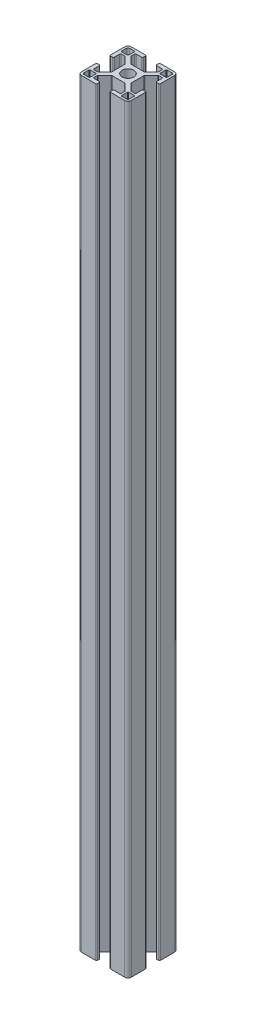
from build123d import *

# Parameters (mm, degrees)
SKETCH1_R           = 3.52998588
BOSS_EXTRUDE1_DEPTH = 228.6


with BuildPart() as part:
    # Sketch1 → Boss-Extrude1 (new, symmetric)
    with BuildSketch(Plane(origin=(0, 0, 0), x_dir=(1, 0, 0), z_dir=(0, 1, 0))):
        with BuildLine():
            Line((14.49994, -4), (13.24247465, -4))
            ThreePointArc((13.24247465, -4), (12.88892126, -4.146446609), (12.74247465, -4.5))
            Line((12.74247465, -4.5), (12.74247465, -7.732519321))
            ThreePointArc((12.74247465, -7.732519321), (12.602449697, -8.097296796), (12.242781236, -8.249967))
            Line((12.242781236, -8.249967), (10.260188032, -8.249967))
            ThreePointArc((10.260188032, -8.249967), (10.068847082, -8.211906919), (9.906636056, -8.103520976))
            Line((9.906636056, -8.103520976), (5.981117769, -4.178002689))
            ThreePointArc((5.981117769, -4.178002689), (5.872731827, -4.015791664), (5.834671745, -3.824450713))
            Line((5.834671745, -3.824450713), (5.834671745, -1.01249595))
            Line((5.834671745, -1.01249595), (5.834671745, 0.88749645))
            Line((5.834671745, 0.88749645), (5.834671745, 3.824450713))
            ThreePointArc((5.834671745, 3.824450713), (5.872731827, 4.015791664), (5.981117769, 4.178002689))
            Line((5.981117769, 4.178002689), (9.906636056, 8.103520976))
            ThreePointArc((9.906636056, 8.103520976), (10.068847082, 8.211906919), (10.260188032, 8.249967))
            Line((10.260188032, 8.249967), (12.242781236, 8.249967))
            ThreePointArc((12.242781236, 8.249967), (12.602449697, 8.097296796), (12.74247465, 7.732519321))
            Line((12.74247465, 7.732519321), (12.74247465, 4.5))
            ThreePointArc((12.74247465, 4.5), (12.88892126, 4.146446609), (13.24247465, 4))
            Line((13.24247465, 4), (14.49994, 4))
            ThreePointArc((14.49994, 4), (14.853493391, 4.146446609), (14.99994, 4.5))
            Line((14.99994, 4.5), (14.99994, 12.999948))
            ThreePointArc((14.99994, 12.999948), (14.414155906, 14.414155906), (12.999948, 14.99994))
            Line((12.999948, 14.99994), (4.5, 14.99994))
            ThreePointArc((4.5, 14.99994), (4.146446609, 14.853493391), (4, 14.49994))
            Line((4, 14.49994), (4, 13.24247465))
            ThreePointArc((4, 13.24247465), (4.146446609, 12.88892126), (4.5, 12.74247465))
            Line((4.5, 12.74247465), (7.732519321, 12.74247465))
            ThreePointArc((7.732519321, 12.74247465), (8.097296796, 12.602449697), (8.249967, 12.242781236))
            Line((8.249967, 12.242781236), (8.249967, 10.260188032))
            ThreePointArc((8.249967, 10.260188032), (8.211906919, 10.068847082), (8.103520976, 9.906636056))
            Line((8.103520976, 9.906636056), (4.178002689, 5.981117769))
            ThreePointArc((4.178002689, 5.981117769), (4.015791664, 5.872731827), (3.824450713, 5.834671745))
            Line((3.824450713, 5.834671745), (0.9499962, 5.834671745))
            Line((0.9499962, 5.834671745), (-0.9499962, 5.834671745))
            Line((-0.9499962, 5.834671745), (-3.824450713, 5.834671745))
            ThreePointArc((-3.824450713, 5.834671745), (-4.015791664, 5.872731827), (-4.178002689, 5.981117769))
            Line((-4.178002689, 5.981117769), (-8.103520976, 9.906636056))
            ThreePointArc((-8.103520976, 9.906636056), (-8.211906919, 10.068847082), (-8.249967, 10.260188032))
            Line((-8.249967, 10.260188032), (-8.249967, 12.242781236))
            ThreePointArc((-8.249967, 12.242781236), (-8.097296796, 12.602449697), (-7.732519321, 12.74247465))
            Line((-7.732519321, 12.74247465), (-4.5, 12.74247465))
            ThreePointArc((-4.5, 12.74247465), (-4.146446609, 12.88892126), (-4, 13.24247465))
            Line((-4, 13.24247465), (-4, 14.49994))
            ThreePointArc((-4, 14.49994), (-4.146446609, 14.853493391), (-4.5, 14.99994))
            Line((-4.5, 14.99994), (-12.999948, 14.99994))
            ThreePointArc((-12.999948, 14.99994), (-14.414155906, 14.414155906), (-14.99994, 12.999948))
            Line((-14.99994, 12.999948), (-14.99994, 4.5))
            ThreePointArc((-14.99994, 4.5), (-14.853493391, 4.146446609), (-14.49994, 4))
            Line((-14.49994, 4), (-13.24247465, 4))
            ThreePointArc((-13.24247465, 4), (-12.88892126, 4.146446609), (-12.74247465, 4.5))
            Line((-12.74247465, 4.5), (-12.74247465, 7.732519321))
            ThreePointArc((-12.74247465, 7.732519321), (-12.602449697, 8.097296796), (-12.242781236, 8.249967))
            Line((-12.242781236, 8.249967), (-10.260188032, 8.249967))
            ThreePointArc((-10.260188032, 8.249967), (-10.068847082, 8.211906919), (-9.906636056, 8.103520976))
            Line((-9.906636056, 8.103520976), (-5.981117769, 4.178002689))
            ThreePointArc((-5.981117769, 4.178002689), (-5.872731827, 4.015791664), (-5.834671745, 3.824450713))
            Line((-5.834671745, 3.824450713), (-5.834671745, 0.88749645))
            Line((-5.834671745, 0.88749645), (-5.834671745, -1.01249595))
            Line((-5.834671745, -1.01249595), (-5.834671745, -3.824450713))
            ThreePointArc((-5.834671745, -3.824450713), (-5.872731827, -4.015791664), (-5.981117769, -4.178002689))
            Line((-5.981117769, -4.178002689), (-9.906636056, -8.103520976))
            ThreePointArc((-9.906636056, -8.103520976), (-10.068847082, -8.211906919), (-10.260188032, -8.249967))
            Line((-10.260188032, -8.249967), (-12.242781236, -8.249967))
            ThreePointArc((-12.242781236, -8.249967), (-12.602449697, -8.097296796), (-12.74247465, -7.732519321))
            Line((-12.74247465, -7.732519321), (-12.74247465, -4.5))
            ThreePointArc((-12.74247465, -4.5), (-12.88892126, -4.146446609), (-13.24247465, -4))
            Line((-13.24247465, -4), (-14.49994, -4))
            ThreePointArc((-14.49994, -4), (-14.853493391, -4.146446609), (-14.99994, -4.5))
            Line((-14.99994, -4.5), (-14.99994, -12.999948))
            ThreePointArc((-14.99994, -12.999948), (-14.414155906, -14.414155906), (-12.999948, -14.99994))
            Line((-12.999948, -14.99994), (-4.5, -14.99994))
            ThreePointArc((-4.5, -14.99994), (-4.146446609, -14.853493391), (-4, -14.49994))
            Line((-4, -14.49994), (-4, -13.24247465))
            ThreePointArc((-4, -13.24247465), (-4.146446609, -12.88892126), (-4.5, -12.74247465))
            Line((-4.5, -12.74247465), (-7.732519321, -12.74247465))
            ThreePointArc((-7.732519321, -12.74247465), (-8.097296796, -12.602449697), (-8.249967, -12.242781236))
            Line((-8.249967, -12.242781236), (-8.249967, -10.260188032))
            ThreePointArc((-8.249967, -10.260188032), (-8.211906919, -10.068847082), (-8.103520976, -9.906636056))
            Line((-8.103520976, -9.906636056), (-4.178002689, -5.981117769))
            ThreePointArc((-4.178002689, -5.981117769), (-4.015791664, -5.872731827), (-3.824450713, -5.834671745))
            Line((-3.824450713, -5.834671745), (-0.9499962, -5.834671745))
            Line((-0.9499962, -5.834671745), (0.9499962, -5.834671745))
            Line((0.9499962, -5.834671745), (3.824450713, -5.834671745))
            ThreePointArc((3.824450713, -5.834671745), (4.015791664, -5.872731827), (4.178002689, -5.981117769))
            Line((4.178002689, -5.981117769), (8.103520976, -9.906636056))
            ThreePointArc((8.103520976, -9.906636056), (8.211906919, -10.068847082), (8.249967, -10.260188032))
            Line((8.249967, -10.260188032), (8.249967, -12.242781236))
            ThreePointArc((8.249967, -12.242781236), (8.097296796, -12.602449697), (7.732519321, -12.74247465))
            Line((7.732519321, -12.74247465), (4.5, -12.74247465))
            ThreePointArc((4.5, -12.74247465), (4.146446609, -12.88892126), (4, -13.24247465))
            Line((4, -13.24247465), (4, -14.49994))
            ThreePointArc((4, -14.49994), (4.146446609, -14.853493391), (4.5, -14.99994))
            Line((4.5, -14.99994), (12.999948, -14.99994))
            ThreePointArc((12.999948, -14.99994), (14.414155906, -14.414155906), (14.99994, -12.999948))
            Line((14.99994, -12.999948), (14.99994, -4.5))
            ThreePointArc((14.99994, -4.5), (14.853493391, -4.146446609), (14.49994, -4))
        make_face()
        with Locations(Location((0, 0, 0), (0, 0, 270))):
            Circle(SKETCH1_R, mode=Mode.SUBTRACT)
        with BuildLine():
            Line((-12.6999492, -13.6999452), (-9.880960476, -13.6999452))
            ThreePointArc((-9.880960476, -13.6999452), (-9.61155387, -13.58835333), (-9.499962, -13.318946724))
            Line((-9.499962, -13.318946724), (-9.499962, -9.87996048))
            ThreePointArc((-9.499962, -9.87996048), (-9.611260978, -9.611260978), (-9.87996048, -9.499962))
            Line((-9.87996048, -9.499962), (-13.318946724, -9.499962))
            ThreePointArc((-13.318946724, -9.499962), (-13.58835333, -9.61155387), (-13.6999452, -9.880960476))
            Line((-13.6999452, -9.880960476), (-13.6999452, -12.6999492))
            ThreePointArc((-13.6999452, -12.6999492), (-13.407053153, -13.407053153), (-12.6999492, -13.6999452))
        make_face(mode=Mode.SUBTRACT)
        with BuildLine():
            Line((13.6999452, -12.6999492), (13.6999452, -9.880960476))
            ThreePointArc((13.6999452, -9.880960476), (13.58835333, -9.61155387), (13.318946724, -9.499962))
            Line((13.318946724, -9.499962), (9.87996048, -9.499962))
            ThreePointArc((9.87996048, -9.499962), (9.611260978, -9.611260978), (9.499962, -9.87996048))
            Line((9.499962, -9.87996048), (9.499962, -13.318946724))
            ThreePointArc((9.499962, -13.318946724), (9.61155387, -13.58835333), (9.880960476, -13.6999452))
            Line((9.880960476, -13.6999452), (12.6999492, -13.6999452))
            ThreePointArc((12.6999492, -13.6999452), (13.407053153, -13.407053153), (13.6999452, -12.6999492))
        make_face(mode=Mode.SUBTRACT)
        with BuildLine():
            Line((9.87996048, 9.499962), (13.318946724, 9.499962))
            ThreePointArc((13.318946724, 9.499962), (13.58835333, 9.61155387), (13.6999452, 9.880960476))
            Line((13.6999452, 9.880960476), (13.6999452, 12.6999492))
            ThreePointArc((13.6999452, 12.6999492), (13.407053153, 13.407053153), (12.6999492, 13.6999452))
            Line((12.6999492, 13.6999452), (9.880960476, 13.6999452))
            ThreePointArc((9.880960476, 13.6999452), (9.61155387, 13.58835333), (9.499962, 13.318946724))
            Line((9.499962, 13.318946724), (9.499962, 9.87996048))
            ThreePointArc((9.499962, 9.87996048), (9.611260978, 9.611260978), (9.87996048, 9.499962))
        make_face(mode=Mode.SUBTRACT)
        with BuildLine():
            Line((-13.6999452, 12.6999492), (-13.6999452, 9.880960476))
            ThreePointArc((-13.6999452, 9.880960476), (-13.58835333, 9.61155387), (-13.318946724, 9.499962))
            Line((-13.318946724, 9.499962), (-9.87996048, 9.499962))
            ThreePointArc((-9.87996048, 9.499962), (-9.611260978, 9.611260978), (-9.499962, 9.87996048))
            Line((-9.499962, 9.87996048), (-9.499962, 13.318946724))
            ThreePointArc((-9.499962, 13.318946724), (-9.61155387, 13.58835333), (-9.880960476, 13.6999452))
            Line((-9.880960476, 13.6999452), (-12.6999492, 13.6999452))
            ThreePointArc((-12.6999492, 13.6999452), (-13.407053153, 13.407053153), (-13.6999452, 12.6999492))
        make_face(mode=Mode.SUBTRACT)
    extrude(amount=BOSS_EXTRUDE1_DEPTH, both=True)


solid = part.part
